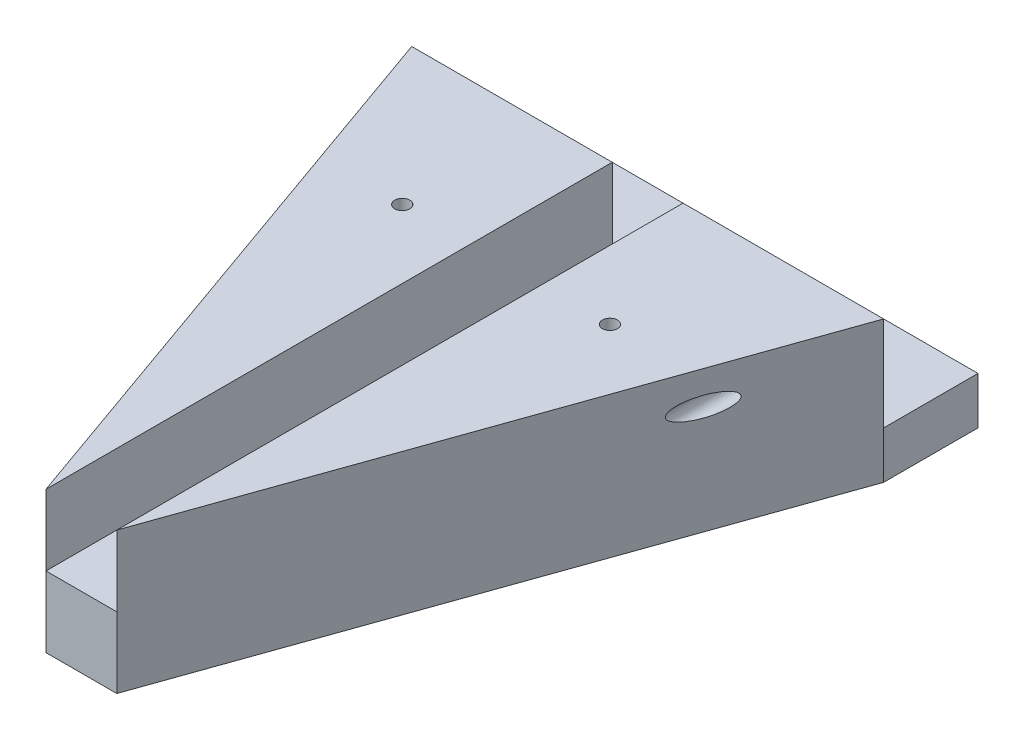
from build123d import *

# Parameters (mm, degrees)
EXTRUDE_1_DEPTH     = 10
EXTRUDE_2_DEPTH     = 15
SKETCH_2_R          = 1.6
CUT_EXTRUDE_1_DEPTH = 15
EXTRUDE_START       = 10
EXTRUDE_3_DEPTH     = 20
SKETCH_5_R          = 1.6
CUT_EXTRUDE_4_DEPTH = 100
SKETCH_6_R          = 1.6
CUT_EXTRUDE_5_DEPTH = 100
CUT_EXTRUDE_START   = -20
SKETCH_7_R          = 2.1
CUT_EXTRUDE_6_DEPTH = 100


with BuildPart() as part:
    # 草图1 → 凸台-拉伸1 (new body)
    with BuildSketch(Plane(origin=(0, 0, 0), x_dir=(1, 0, 0), z_dir=(0, 1, 0))):
        Polygon((-50, 10), (-50, -10), (-7.5, -130), (7.5, -130), (50, -10), (50, 10), align=None)
    extrude(amount=EXTRUDE_1_DEPTH)

    # 草图1<3> → 凸台-拉伸2 (add)
    with BuildSketch(Plane(origin=(0, 0, 0), x_dir=(1, 0, 0), z_dir=(0, 1, 0))):
        Polygon((-50, -10), (-7.5, -130), (7.5, -130), (50, -10), align=None)
    extrude(amount=EXTRUDE_2_DEPTH)

    # 草图2 → 切除-拉伸1 (cut)
    with BuildSketch(Plane(origin=(0, 10, 0), x_dir=(1, 0, 0), z_dir=(0, 1, 0))):
        with Locations((20, 0)):
            Circle(SKETCH_2_R)
        with Locations((-20, 0)):
            Circle(SKETCH_2_R)
    extrude(amount=-CUT_EXTRUDE_1_DEPTH, mode=Mode.SUBTRACT)

    # 草图1<4> → 凸台-拉伸3 (add)
    with BuildSketch(Plane(origin=(0, 0, 0), x_dir=(1, 0, 0), z_dir=(0, 1, 0)).offset(EXTRUDE_START)):
        Polygon((-7.5, -10), (-50, -10), (-7.5, -130), align=None)
        Polygon((50, -10), (7.5, -10), (7.5, -130), align=None)
    extrude(amount=EXTRUDE_3_DEPTH)

    # 草图5 → 切除-拉伸4 (cut)
    with BuildSketch(Plane(origin=(0, 30, 0), x_dir=(1, 0, 0), z_dir=(0, 1, 0))):
        with Locations((22, -40)):
            Circle(SKETCH_5_R)
        with Locations((-22, -40)):
            Circle(SKETCH_5_R)
    extrude(amount=-CUT_EXTRUDE_4_DEPTH, mode=Mode.SUBTRACT)

    # 草图6 → 切除-拉伸5 (cut)
    with BuildSketch(Plane(origin=(0, 0, 10), x_dir=(-1, 0, 0), z_dir=(0, 0, -1))):
        with Locations((40, 23)):
            Circle(SKETCH_6_R)
        with Locations((-40, 23)):
            Circle(SKETCH_6_R)
    extrude(amount=-CUT_EXTRUDE_5_DEPTH, mode=Mode.SUBTRACT)

    # 草图7 → 切除-拉伸6 (cut)
    with BuildSketch(Plane(origin=(0, 0, 10), x_dir=(-1, 0, 0), z_dir=(0, 0, -1)).offset(CUT_EXTRUDE_START)):
        with Locations((-40, 23)):
            Circle(SKETCH_7_R)
        with Locations((40, 23)):
            Circle(SKETCH_7_R)
    extrude(amount=-CUT_EXTRUDE_6_DEPTH, mode=Mode.SUBTRACT)


solid = part.part
